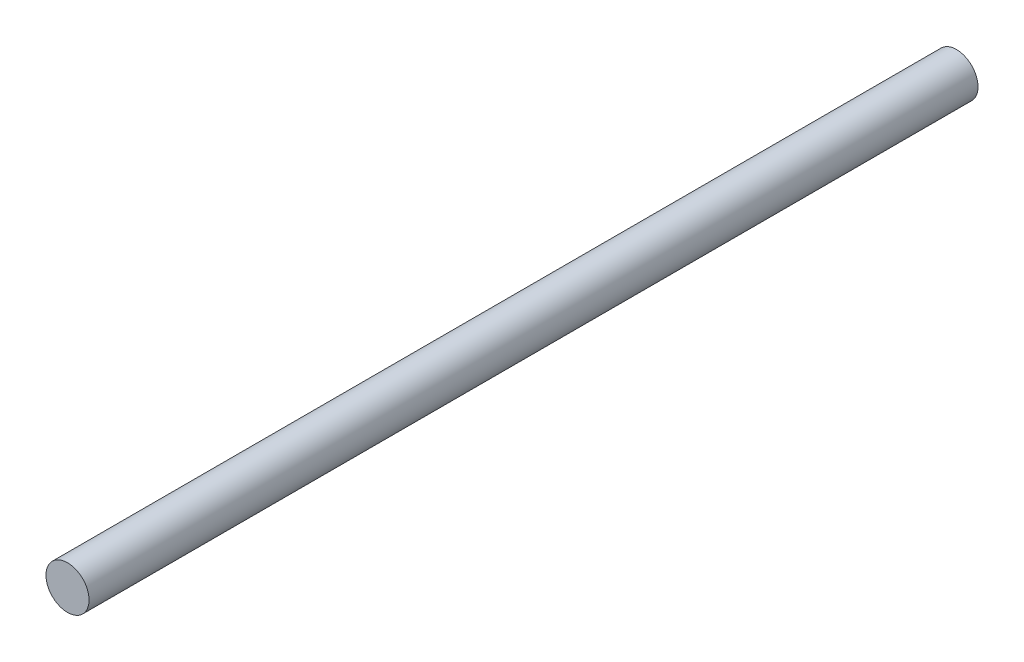
from build123d import *

# Parameters (mm, degrees)
ESQUISSE1_R        = 4
BOSS_EXTRU_1_DEPTH = 165


with BuildPart() as part:
    # Esquisse1 → Boss.-Extru.1 (new body)
    with BuildSketch(Plane.XY):
        Circle(ESQUISSE1_R)
    extrude(amount=BOSS_EXTRU_1_DEPTH)


solid = part.part
